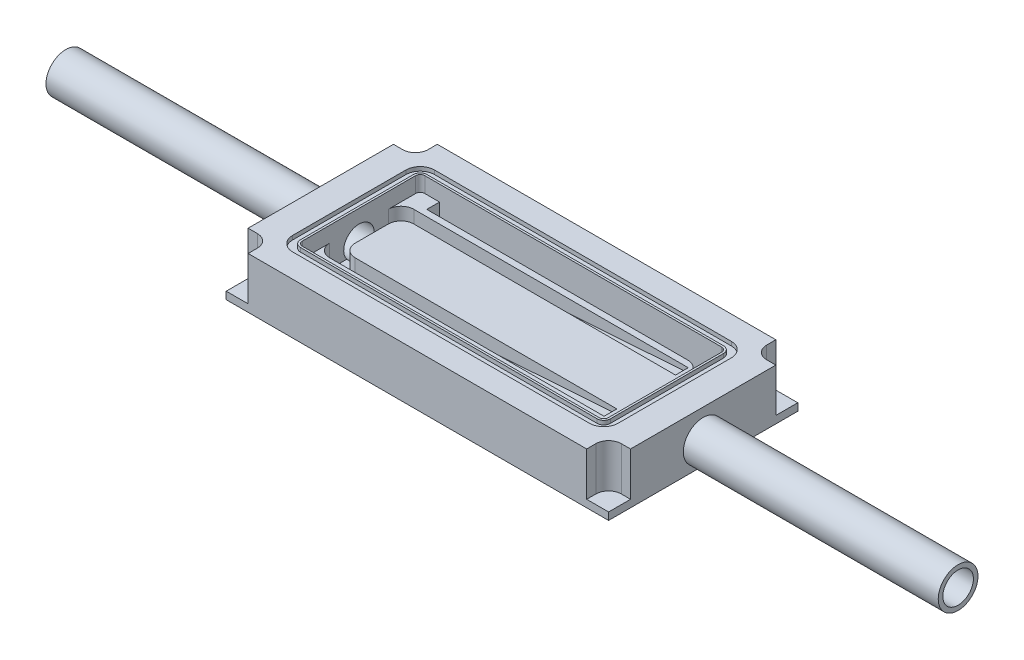
from build123d import *

# Parameters (mm, degrees)
SKETCH2_W                                = 190.5
SKETCH2_H                                = 94.234
BOSS_EXTRUDE1_DEPTH                      = 25.4
SKETCH3_W                                = 152.4
SKETCH3_H                                = 60.96
CUT_EXTRUDE1_DEPTH                       = 7.7216
FILLET1_R                                = 2.286
CUT_EXTRUDE2_DEPTH                       = 1.9939
CUT_EXTRUDE3_DEPTH                       = 21.717
MIRROR1_AT_THE_SECOND_PLANE_COPY_1_DEPTH = 21.717
CUT_EXTRUDE6_DEPTH                       = 11.22531918
SKETCH10_R                               = 9.906
SKETCH10_R_2                             = 7.62
BOSS_EXTRUDE2_DEPTH                      = 127
CUT_EXTRUDE9_START                       = -25.4
SKETCH16_R                               = 7.62
CUT_EXTRUDE9_DEPTH                       = 25.4
BOSS_EXTRUDE3_REACH                      = 235.825


with BuildPart() as part:
    # Sketch2 → Boss-Extrude1 (new body)
    with BuildSketch(Plane(origin=(0, 0, 0), x_dir=(1, 0, 0), z_dir=(0, 1, 0))):
        Rectangle(SKETCH2_W, SKETCH2_H)
    extrude(amount=BOSS_EXTRUDE1_DEPTH)

    # Sketch3 → Cut-Extrude1 (cut)
    with BuildSketch(Plane(origin=(0, 25.4, 0), x_dir=(1, 0, 0), z_dir=(0, 1, 0))):
        Rectangle(SKETCH3_W, SKETCH3_H)
    extrude(amount=-CUT_EXTRUDE1_DEPTH, mode=Mode.SUBTRACT)

    # Fillet1
    fillet1_edges = [part.edges().sort_by_distance(p)[0] for p in [
        (76.2, 21.5392, -30.48),
        (76.2, 21.5392, 30.48),
        (-76.2, 21.5392, 30.48),
        (-76.2, 21.5392, -30.48),
    ]]
    fillet(fillet1_edges, radius=FILLET1_R)

    # Sketch5 → Cut-Extrude2 (cut)
    with BuildSketch(Plane(origin=(0, 25.4, 0), x_dir=(1, 0, 0), z_dir=(0, 1, 0))):
        with BuildLine():
            Line((-73.914, -35.3441), (73.914, -35.3441))
            ThreePointArc((73.914, -35.3441), (78.969884196, -33.249884196), (81.0641, -28.194))
            Line((81.0641, -28.194), (81.0641, 28.194))
            ThreePointArc((81.0641, 28.194), (78.969884196, 33.249884196), (73.914, 35.3441))
            Line((73.914, 35.3441), (-73.914, 35.3441))
            ThreePointArc((-73.914, 35.3441), (-78.969884196, 33.249884196), (-81.0641, 28.194))
            Line((-81.0641, 28.194), (-81.0641, -28.194))
            ThreePointArc((-81.0641, -28.194), (-78.969884196, -33.249884196), (-73.914, -35.3441))
        make_face()
        with BuildLine():
            Line((-73.914, -31.496), (73.914, -31.496))
            ThreePointArc((73.914, -31.496), (76.248866591, -30.528866591), (77.216, -28.194))
            Line((77.216, -28.194), (77.216, 28.194))
            ThreePointArc((77.216, 28.194), (76.248866591, 30.528866591), (73.914, 31.496))
            Line((73.914, 31.496), (-73.914, 31.496))
            ThreePointArc((-73.914, 31.496), (-76.248866591, 30.528866591), (-77.216, 28.194))
            Line((-77.216, 28.194), (-77.216, -28.194))
            ThreePointArc((-77.216, -28.194), (-76.248866591, -30.528866591), (-73.914, -31.496))
        make_face(mode=Mode.SUBTRACT)
    extrude(amount=-CUT_EXTRUDE2_DEPTH, mode=Mode.SUBTRACT)

    # Sketch6 → Cut-Extrude3 (cut)
    with BuildSketch(Plane(origin=(0, 25.4, 0), x_dir=(1, 0, 0), z_dir=(0, 1, 0))):
        with BuildLine():
            Line((-84.328, 47.117), (-84.328, 42.545))
            ThreePointArc((-84.328, 42.545), (-86.187871939, 38.054871939), (-90.678, 36.195))
            Line((-90.678, 36.195), (-95.25, 36.195))
            Line((-95.25, 36.195), (-95.25, 47.117))
            Line((-95.25, 47.117), (-84.328, 47.117))
        make_face()
    cut_extrude3 = extrude(amount=-CUT_EXTRUDE3_DEPTH, mode=Mode.SUBTRACT)

    # Mirror1: Cut-Extrude3 across plane
    add(cut_extrude3.mirror(Plane(origin=(0, 0, 0), x_dir=(0, 0, 1), z_dir=(1, 0, 0))), mode=Mode.SUBTRACT)

    # Mirror1 at the second plane: Cut-Extrude3 across plane
    add(cut_extrude3.mirror(Plane.XY), mode=Mode.SUBTRACT)

    # Mirror1 at the second plane copy 1 sketc → Mirror1 at the second plane copy 1 (cut)
    with BuildSketch(Plane(origin=(0, 25.4, 0), x_dir=(-1, 0, 0), z_dir=(0, 1, 0))):
        with BuildLine():
            Line((-84.328, 47.117), (-84.328, 42.545))
            ThreePointArc((-84.328, 42.545), (-86.187871939, 38.054871939), (-90.678, 36.195))
            Line((-90.678, 36.195), (-95.25, 36.195))
            Line((-95.25, 36.195), (-95.25, 47.117))
            Line((-95.25, 47.117), (-84.328, 47.117))
        make_face()
    extrude(amount=-MIRROR1_AT_THE_SECOND_PLANE_COPY_1_DEPTH, mode=Mode.SUBTRACT)

    # Sketch13 → Cut-Extrude6 (cut)
    with BuildSketch(Plane(origin=(0, 17.6784, 0), x_dir=(1, 0, 0), z_dir=(0, 1, 0))):
        with BuildLine():
            Line((-63.000000018, 24.13), (63.5, 24.13))
            ThreePointArc((63.5, 24.13), (67.990128061, 22.270128061), (69.85, 17.78))
            Line((69.85, 17.78), (69.85, -17.78))
            ThreePointArc((69.85, -17.78), (67.990128061, -22.270128061), (63.5, -24.13))
            Line((63.5, -24.13), (-63.000000018, -24.13))
            ThreePointArc((-63.000000018, -24.13), (-66.175000018, -27.305), (-63.000000018, -30.48))
            Line((-63.000000018, -30.48), (69.85, -30.48))
            ThreePointArc((69.85, -30.48), (74.340128061, -28.620128061), (76.2, -24.13))
            Line((76.2, -24.13), (76.2, 24.13))
            ThreePointArc((76.2, 24.13), (74.340128061, 28.620128061), (69.85, 30.48))
            Line((69.85, 30.48), (-63.000000018, 30.48))
            ThreePointArc((-63.000000018, 30.48), (-66.175000018, 27.305), (-63.000000018, 24.13))
        make_face()
        with BuildLine():
            Line((-66.580399175, 24.13), (-63.000000018, 24.13))
            ThreePointArc((-63.000000018, 24.13), (-66.175000018, 27.305), (-63.000000018, 30.48))
            Line((-63.000000018, 30.48), (-66.580399175, 30.48))
            Line((-66.580399175, 30.48), (-66.580399175, 24.13))
        make_face()
        with BuildLine():
            Line((-76.2, 14.605), (-76.2, -14.605))
            ThreePointArc((-76.2, -14.605), (-74.340128061, -19.095128061), (-69.85, -20.955))
            Line((-69.85, -20.955), (63.000000018, -20.955))
            ThreePointArc((63.000000018, -20.955), (66.175000018, -17.78), (63.000000018, -14.605))
            Line((63.000000018, -14.605), (-63.5, -14.605))
            ThreePointArc((-63.5, -14.605), (-67.990128061, -12.745128061), (-69.85, -8.255))
            Line((-69.85, -8.255), (-69.85, 8.255))
            ThreePointArc((-69.85, 8.255), (-67.990128061, 12.745128061), (-63.5, 14.605))
            Line((-63.5, 14.605), (63.000000018, 14.605))
            ThreePointArc((63.000000018, 14.605), (66.175000018, 17.78), (63.000000018, 20.955))
            Line((63.000000018, 20.955), (-69.85, 20.955))
            ThreePointArc((-69.85, 20.955), (-74.340128061, 19.095128061), (-76.2, 14.605))
        make_face()
        with BuildLine():
            Line((63.000000018, 20.955), (66.84830001, 20.955))
            Line((66.84830001, 20.955), (66.84830001, 14.605))
            Line((66.84830001, 14.605), (63.000000018, 14.605))
            ThreePointArc((63.000000018, 14.605), (66.175000018, 17.78), (63.000000018, 20.955))
        make_face()
        with BuildLine():
            ThreePointArc((63.000000018, -20.955), (66.175000018, -17.78), (63.000000018, -14.605))
            Line((63.000000018, -14.605), (66.84830001, -14.605))
            Line((66.84830001, -14.605), (66.84830001, -20.955))
            Line((66.84830001, -20.955), (63.000000018, -20.955))
        make_face()
        with BuildLine():
            ThreePointArc((-63.000000018, -30.48), (-66.175000018, -27.305), (-63.000000018, -24.13))
            Line((-63.000000018, -24.13), (-66.580399175, -24.13))
            Line((-66.580399175, -24.13), (-66.580399175, -30.48))
            Line((-66.580399175, -30.48), (-63.000000018, -30.48))
        make_face()
    extrude(amount=-CUT_EXTRUDE6_DEPTH, mode=Mode.SUBTRACT)

    # Sketch10 → Boss-Extrude2 (add)
    with BuildSketch(Plane(origin=(95.25, 0, 0), x_dir=(0, 0, -1), z_dir=(1, 0, 0))):
        with Locations(Location((0, 10.996509823, 0), (0, 0, 180))):
            Circle(SKETCH10_R)
        with Locations((0, 10.996509823)):
            Circle(SKETCH10_R_2, mode=Mode.SUBTRACT)
    boss_extrude2 = extrude(amount=BOSS_EXTRUDE2_DEPTH)

    # Sketch16 → Cut-Extrude9 (cut)
    with BuildSketch(Plane(origin=(95.25, 0, 0), x_dir=(0, 0, -1), z_dir=(1, 0, 0)).offset(CUT_EXTRUDE9_START)):
        with Locations(Location((0, 10.996509823, 0), (0, 0, 216.601830643))):
            Circle(SKETCH16_R)
    cut_extrude9 = extrude(amount=CUT_EXTRUDE9_DEPTH, mode=Mode.SUBTRACT)

    # Mirror2: Boss-Extrude2, Cut-Extrude9 across plane
    add(boss_extrude2.mirror(Plane(origin=(0, 0, 0), x_dir=(0, 0, 1), z_dir=(1, 0, 0))))
    add(cut_extrude9.mirror(Plane(origin=(0, 0, 0), x_dir=(0, 0, 1), z_dir=(1, 0, 0))), mode=Mode.SUBTRACT)

    # Boss-Extrude3: up to this face of the body (flat: up to its plane)
    boss_extrude3_end = Plane(part.part.faces().sort_by_distance((-1.500849995, 12.06574041, 20.955))[0])
    # Sketch17 → Boss-Extrude3 (add, up to the picked face)
    with BuildSketch(Plane.XY.offset(-20.955), mode=Mode.PRIVATE) as boss_extrude3_sk1:
        Polygon((66.84830001, 6.45308082), (66.84830001, 15.43307302), (-63.5, 6.45308082), align=None)
    boss_extrude3_tool1 = split(extrude(boss_extrude3_sk1.sketch, amount=BOSS_EXTRUDE3_REACH, mode=Mode.PRIVATE), bisect_by=boss_extrude3_end, keep=Keep.BOTH, mode=Mode.PRIVATE)
    add(boss_extrude3_tool1.solids().sort_by(Axis((23.398867, 9.446412, -20.955), (0, 0, 1)))[0])


solid = part.part
